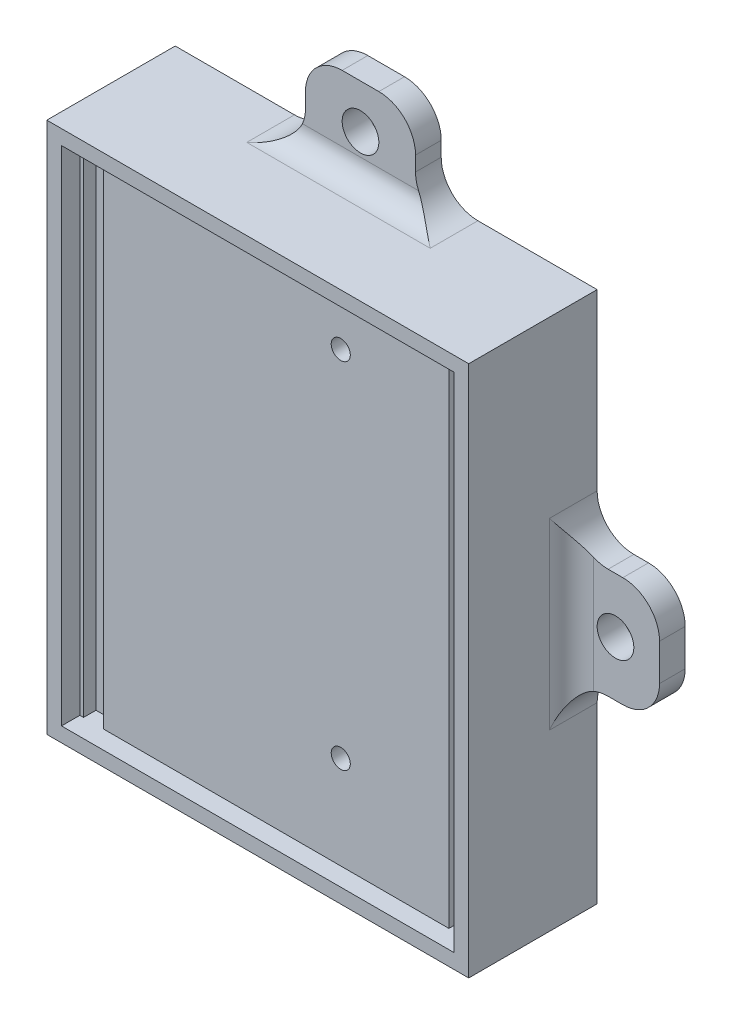
from build123d import *

# Parameters (mm, degrees)
SKETCH1_W                = 53.5
SKETCH1_H                = 68.5
BOSS_EXTRUDE1_DEPTH      = 15
BOSS_EXTRUDE2_DEPTH      = 2.5
BOSS_EXTRUDE2_DEPTH_BACK = 15
SKETCH2_W                = 57.5
SKETCH2_H                = 72.5
SKETCH2_W_2              = 53.5
SKETCH2_H_2              = 68.5
SKETCH3_W                = 2.7
SKETCH3_H                = 68.5
CUT_EXTRUDE1_DEPTH       = 1.7
SKETCH4_R                = 1.3
CUT_EXTRUDE2_DEPTH       = 7
SKETCH5_W                = 15
SKETCH5_H                = 12
SKETCH5_R                = 2.5
SKETCH5_W_2              = 12
SKETCH5_H_2              = 15
BOSS_EXTRUDE3_DEPTH      = 3.5
FILLET1_R                = 5
FILLET2_R                = 3


with BuildPart() as part:
    # Sketch1 → Boss-Extrude1 (new body)
    with BuildSketch(Plane.XY):
        with Locations((26.75, 34.25)):
            Rectangle(SKETCH1_W, SKETCH1_H)
    extrude(amount=BOSS_EXTRUDE1_DEPTH)

    # Sketch2 → Boss-Extrude2 (add, two sides: drawn at the far end of the back side and taken through both)
    with BuildSketch(Plane.XY.offset(15).offset(-BOSS_EXTRUDE2_DEPTH_BACK)):
        with Locations((26.75, 34.25)):
            Rectangle(SKETCH2_W, SKETCH2_H)
        with Locations((26.75, 34.25)):
            Rectangle(SKETCH2_W_2, SKETCH2_H_2, mode=Mode.SUBTRACT)
    extrude(amount=BOSS_EXTRUDE2_DEPTH + BOSS_EXTRUDE2_DEPTH_BACK)

    # Sketch3 → Cut-Extrude1 (cut)
    with BuildSketch(Plane.XY.offset(15)):
        with Locations((1.85, 34.25)):
            Rectangle(SKETCH3_W, SKETCH3_H)
        with Locations((51.65, 34.25)):
            Rectangle(SKETCH3_W, SKETCH3_H)
    extrude(amount=-CUT_EXTRUDE1_DEPTH, mode=Mode.SUBTRACT)

    # Sketch4 → Cut-Extrude2 (cut)
    with BuildSketch(Plane.XY.offset(15)):
        with Locations((35.56, 12.7)):
            Circle(SKETCH4_R)
        with Locations((35.56, 60.96)):
            Circle(SKETCH4_R)
    extrude(amount=-CUT_EXTRUDE2_DEPTH, mode=Mode.SUBTRACT)

    # Sketch5 → Boss-Extrude3 (add)
    # profile 1 of 4: a face of its own
    with BuildSketch(Plane(origin=(0, 0, 0), x_dir=(-1, 0, 0), z_dir=(0, 0, -1))):
        with Locations((-26.75, -8)):
            Rectangle(SKETCH5_W, SKETCH5_H)
        with Locations((-26.75, -8)):
            Circle(SKETCH5_R, mode=Mode.SUBTRACT)
    # profile 2 of 4: a face of its own
    with BuildSketch(Plane(origin=(0, 0, 0), x_dir=(-1, 0, 0), z_dir=(0, 0, -1))):
        with Locations((8, 34.25)):
            Rectangle(SKETCH5_W_2, SKETCH5_H_2)
        with Locations((8, 34.25)):
            Circle(SKETCH5_R, mode=Mode.SUBTRACT)
    # profile 3 of 4: a face of its own
    with BuildSketch(Plane(origin=(0, 0, 0), x_dir=(-1, 0, 0), z_dir=(0, 0, -1))):
        with Locations((-61.5, 34.25)):
            Rectangle(SKETCH5_W_2, SKETCH5_H_2)
        with Locations((-61.5, 34.25)):
            Circle(SKETCH5_R, mode=Mode.SUBTRACT)
    # profile 4 of 4: a face of its own
    with BuildSketch(Plane(origin=(0, 0, 0), x_dir=(-1, 0, 0), z_dir=(0, 0, -1))):
        with Locations((-26.75, 76.5)):
            Rectangle(SKETCH5_W, SKETCH5_H)
        with Locations((-26.75, 76.5)):
            Circle(SKETCH5_R, mode=Mode.SUBTRACT)
    extrude(amount=-BOSS_EXTRUDE3_DEPTH)

    # Fillet1
    fillet1_edges = [part.edges().sort_by_distance(p)[0] for p in [
        (55.5, 41.75, 1.75),
        (55.5, 26.75, 1.75),
        (67.5, 26.75, 1.75),
        (67.5, 41.75, 1.75),
        (34.25, 70.5, 1.75),
        (34.25, 82.5, 1.75),
        (19.25, 82.5, 1.75),
        (19.25, 70.5, 1.75),
        (34.25, -14, 1.75),
        (34.25, -2, 1.75),
        (19.25, -2, 1.75),
        (19.25, -14, 1.75),
        (-2, 26.75, 1.75),
        (-2, 41.75, 1.75),
        (-14, 41.75, 1.75),
        (-14, 26.75, 1.75),
    ]]
    fillet(fillet1_edges, radius=FILLET1_R)

    # Fillet2
    fillet2_edges = [part.edges().sort_by_distance(p)[0] for p in [
        (55.5, 34.25, 3.5),
        (26.75, 70.5, 3.5),
        (26.75, -2, 3.5),
        (-2, 34.25, 3.5),
    ]]
    fillet(fillet2_edges, radius=FILLET2_R)


solid = part.part
